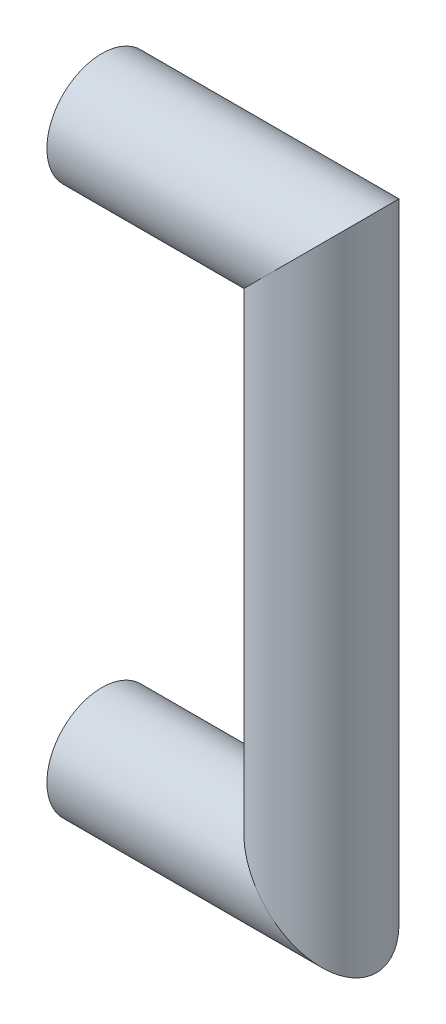
from build123d import *

# Parameters (mm, degrees)
SKETCH1_R = 10


with BuildPart() as part:
    # Sweep1: sweep along a path in Sketch3
    with BuildLine(Plane.XY) as sweep1_path:
        Line((0, 0), (40, 0))
        Line((40, 0), (40, -100))
        Line((40, -100), (0, -100))
    # Sketch1 → Sweep1 (sweep)
    with BuildSketch(Plane(origin=(0, 0, 0), x_dir=(0, 0, -1), z_dir=(1, 0, 0))):
        Circle(SKETCH1_R)
    sweep(path=sweep1_path.line, transition=Transition.RIGHT)


solid = part.part
